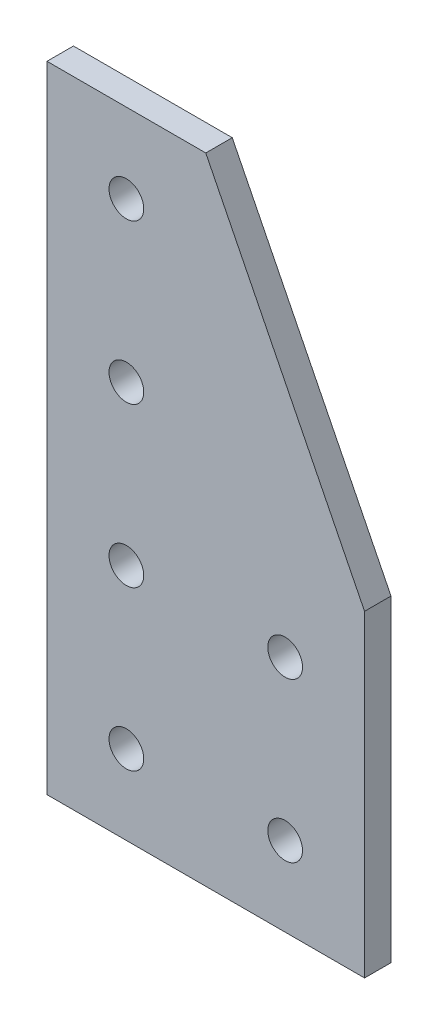
from build123d import *

# Parameters (mm, degrees)
BOSS_EXTRUDE1_DEPTH      = 3.175
BOSS_EXTRUDE1_DEPTH_BACK = 3.175
SKETCH4_R                = 4.1656
CUT_EXTRUDE1_DEPTH       = 86.430512699


with BuildPart() as part:
    # Sketch3 → Boss-Extrude1 (new, two sides: drawn at the far end of the back side and taken through both)
    with BuildSketch(Plane.XY.offset(-BOSS_EXTRUDE1_DEPTH_BACK)):
        Polygon((0, 76.2), (-38.1, 76.2), (-38.1, -76.2), (38.1, -76.2), (38.1, 0), align=None)
    extrude(amount=BOSS_EXTRUDE1_DEPTH + BOSS_EXTRUDE1_DEPTH_BACK)

    # Sketch4 → Cut-Extrude1 (cut, through all)
    with BuildSketch(Plane.XY.offset(3.175)):
        with Locations((-19.05, -57.15)):
            Circle(SKETCH4_R)
        with Locations((19.05, -57.15)):
            Circle(SKETCH4_R)
        with Locations((19.05, -19.05)):
            Circle(SKETCH4_R)
        with Locations((-19.05, -19.05)):
            Circle(SKETCH4_R)
        with Locations((-19.05, 19.05)):
            Circle(SKETCH4_R)
        with Locations((-19.05, 57.15)):
            Circle(SKETCH4_R)
    extrude(amount=-CUT_EXTRUDE1_DEPTH, mode=Mode.SUBTRACT)


solid = part.part
